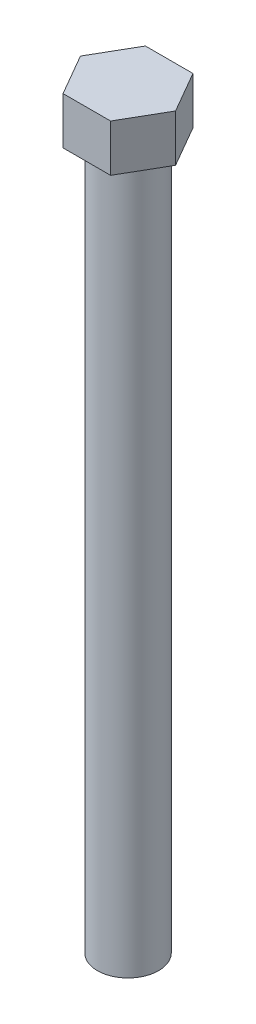
from build123d import *

# Parameters (mm, degrees)
SKETCH1_R           = 0.13
BOSS_EXTRUDE1_DEPTH = 3
BOSS_EXTRUDE2_DEPTH = 0.2


with BuildPart() as part:
    # Sketch1 → Boss-Extrude1 (new body)
    with BuildSketch(Plane(origin=(0, 0, 0), x_dir=(1, 0, 0), z_dir=(0, 1, 0))):
        Circle(SKETCH1_R)
    extrude(amount=-BOSS_EXTRUDE1_DEPTH)

    # Sketch1<3> → Boss-Extrude2 (add)
    with BuildSketch(Plane(origin=(0, 0, 0), x_dir=(1, 0, 0), z_dir=(0, 1, 0))):
        Polygon((-0.101036297, -0.175), (0.101036297, -0.175), (0.202072594, 0), (0.101036297, 0.175), (-0.101036297, 0.175), (-0.202072594, 0), align=None)
    extrude(amount=BOSS_EXTRUDE2_DEPTH)


solid = part.part
